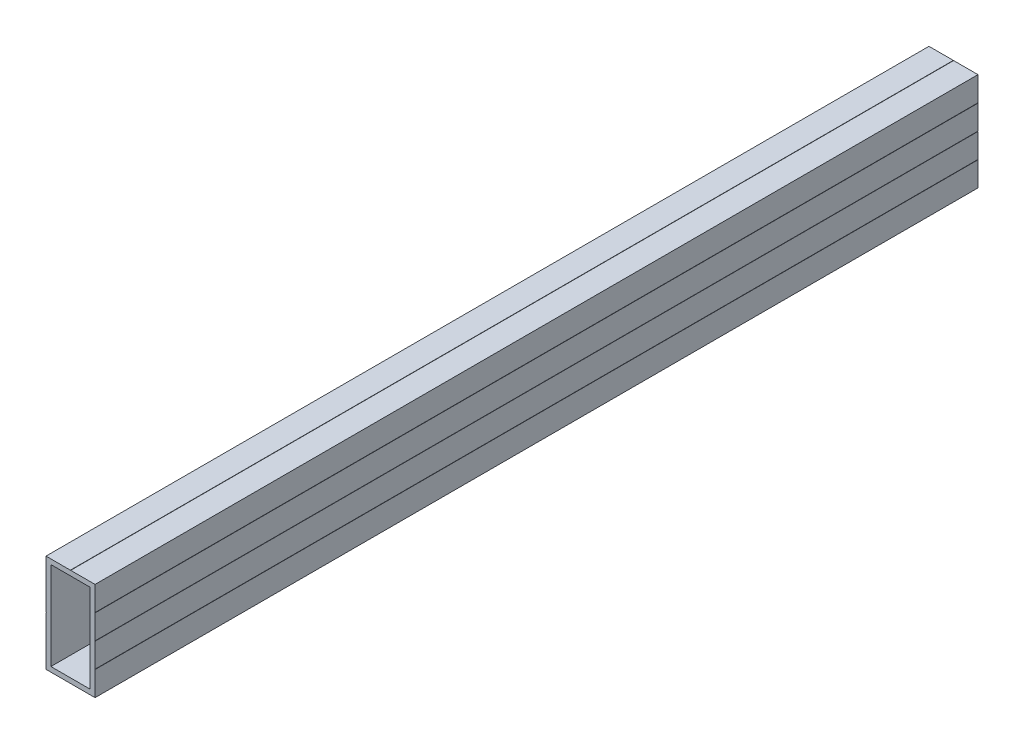
from build123d import *

# Parameters (mm, degrees)
SKETCH1_W           = 1498.6
SKETCH1_H           = 50.8
BOSS_EXTRUDE1_DEPTH = 25.4
CUT_EXTRUDE1_DEPTH  = 1498.6
CUT_EXTRUDE2_DEPTH  = 1499.869043646
CUT_EXTRUDE3_DEPTH  = 1498.6
CUT_EXTRUDE4_DEPTH  = 1498.6
CUT_EXTRUDE5_DEPTH  = 1499.869043646
CUT_EXTRUDE6_DEPTH  = 1499.869043646
CUT_EXTRUDE7_DEPTH  = 1498.6
CUT_EXTRUDE8_DEPTH  = 1498.6
SKETCH10_W          = 20.32
SKETCH10_H          = 45.72
CUT_EXTRUDE9_DEPTH  = 1499.869043646
DRAFT1_ANGLE        = 45
DRAFT2_ANGLE        = 45.000000005
DRAFT3_ANGLE        = 45
DRAFT4_ANGLE        = 45
DRAFT5_ANGLE        = 45
DRAFT6_ANGLE        = 44.999999995
SKETCH11_W          = 61.962293059
SKETCH11_H          = 88.678950317
CUT_EXTRUDE10_DEPTH = 1041.4


with BuildPart() as part:
    # Sketch1 → Boss-Extrude1 (new body)
    with BuildSketch(Plane(origin=(12.7, 0, 0), x_dir=(0, 0, -1), z_dir=(1, 0, 0))):
        Rectangle(SKETCH1_W, SKETCH1_H)
    extrude(amount=-BOSS_EXTRUDE1_DEPTH)

    # Sketch2 → Cut-Extrude1 (cut)
    with BuildSketch(Plane.XY.offset(749.3)):
        Polygon((0.0762, 25.4), (-0.0762, 25.4), (0.0762, 25.2476), align=None)
    extrude(amount=-CUT_EXTRUDE1_DEPTH, mode=Mode.SUBTRACT)

    # Sketch3 → Cut-Extrude2 (cut, through all)
    with BuildSketch(Plane.XY.offset(749.3)):
        Polygon((12.7, 12.6238), (12.7, 12.7762), (12.5476, 12.7762), align=None)
    extrude(amount=-CUT_EXTRUDE2_DEPTH, mode=Mode.SUBTRACT)

    # Sketch4 → Cut-Extrude3 (cut)
    with BuildSketch(Plane.XY.offset(749.3)):
        Polygon((12.7, -0.0762), (12.7, 0.0762), (12.5476, -0.0762), align=None)
    extrude(amount=-CUT_EXTRUDE3_DEPTH, mode=Mode.SUBTRACT)

    # Sketch5 → Cut-Extrude4 (cut)
    with BuildSketch(Plane.XY.offset(749.3)):
        Polygon((12.7, -12.7762), (12.7, -12.6238), (12.5476, -12.6238), align=None)
    extrude(amount=-CUT_EXTRUDE4_DEPTH, mode=Mode.SUBTRACT)

    # Sketch6 → Cut-Extrude5 (cut, through all)
    with BuildSketch(Plane.XY.offset(749.3)):
        Polygon((0.0762, -25.4), (-0.0762, -25.2476), (-0.0762, -25.4), align=None)
    extrude(amount=-CUT_EXTRUDE5_DEPTH, mode=Mode.SUBTRACT)

    # Sketch7 → Cut-Extrude6 (cut, through all)
    with BuildSketch(Plane.XY.offset(749.3)):
        Polygon((-12.7, -12.6238), (-12.7, -12.7762), (-12.5476, -12.7762), align=None)
    extrude(amount=-CUT_EXTRUDE6_DEPTH, mode=Mode.SUBTRACT)

    # Sketch8 → Cut-Extrude7 (cut)
    with BuildSketch(Plane.XY.offset(749.3)):
        Polygon((-12.7, 0.0762), (-12.7, -0.0762), (-12.5476, 0.0762), align=None)
    extrude(amount=-CUT_EXTRUDE7_DEPTH, mode=Mode.SUBTRACT)

    # Sketch9 → Cut-Extrude8 (cut)
    with BuildSketch(Plane.XY.offset(749.3)):
        Polygon((-12.7, 12.7762), (-12.7, 12.6238), (-12.5476, 12.6238), align=None)
    extrude(amount=-CUT_EXTRUDE8_DEPTH, mode=Mode.SUBTRACT)

    # Sketch10 → Cut-Extrude9 (cut, through all)
    with BuildSketch(Plane.XY.offset(749.3)):
        Rectangle(SKETCH10_W, SKETCH10_H)
    extrude(amount=-CUT_EXTRUDE9_DEPTH, mode=Mode.SUBTRACT)

    # Draft1
    draft1_faces = [part.faces().sort_by_distance(p)[0] for p in [
        (0.0762, 25.3238, 0),
    ]]
    draft(draft1_faces, Plane(origin=(-12.7, 25.4, -749.3), x_dir=(0, 0, 1), z_dir=(0, 1, 0)), DRAFT1_ANGLE)

    # Draft2
    draft2_faces = [part.faces().sort_by_distance(p)[0] for p in [
        (12.6238, 12.7762, 0),
    ]]
    draft(draft2_faces, Plane(origin=(12.7, 0, 0), x_dir=(0, 0, 1), z_dir=(1, 0, 0)), DRAFT2_ANGLE)

    # Draft3
    draft3_faces = [part.faces().sort_by_distance(p)[0] for p in [
        (-0.0762, -25.3238, 0),
    ]]
    draft(draft3_faces, Plane(origin=(-12.7, -25.4, 749.3), x_dir=(0, 0, -1), z_dir=(0, -1, 0)), DRAFT3_ANGLE)

    # Draft4
    draft4_faces = [part.faces().sort_by_distance(p)[0] for p in [
        (-12.6238, -12.7762, 0),
    ]]
    draft(draft4_faces, Plane(origin=(-12.7, 0, 0), x_dir=(0, 0, -1), z_dir=(-1, 0, 0)), DRAFT4_ANGLE)

    # Draft5
    draft5_faces = [part.faces().sort_by_distance(p)[0] for p in [
        (12.6238, -12.6238, 0),
        (12.6238, 0, 0),
    ]]
    draft(draft5_faces, Plane(origin=(12.7, 0, 0), x_dir=(0, 0, 1), z_dir=(1, 0, 0)), DRAFT5_ANGLE)

    # Draft6
    draft6_faces = [part.faces().sort_by_distance(p)[0] for p in [
        (-12.6238, 0, 0),
        (-12.6238, 12.6238, 0),
    ]]
    draft(draft6_faces, Plane(origin=(-12.7, 0, 0), x_dir=(0, 0, -1), z_dir=(-1, 0, 0)), DRAFT6_ANGLE)

    # Sketch11 → Cut-Extrude10 (cut)
    with BuildSketch(Plane(origin=(0, 0, -749.3), x_dir=(-1, 0, 0), z_dir=(0, 0, -1))):
        with Locations((-2.92473676, 0.325700182)):
            Rectangle(SKETCH11_W, SKETCH11_H)
    extrude(amount=-CUT_EXTRUDE10_DEPTH, mode=Mode.SUBTRACT)


solid = part.part
